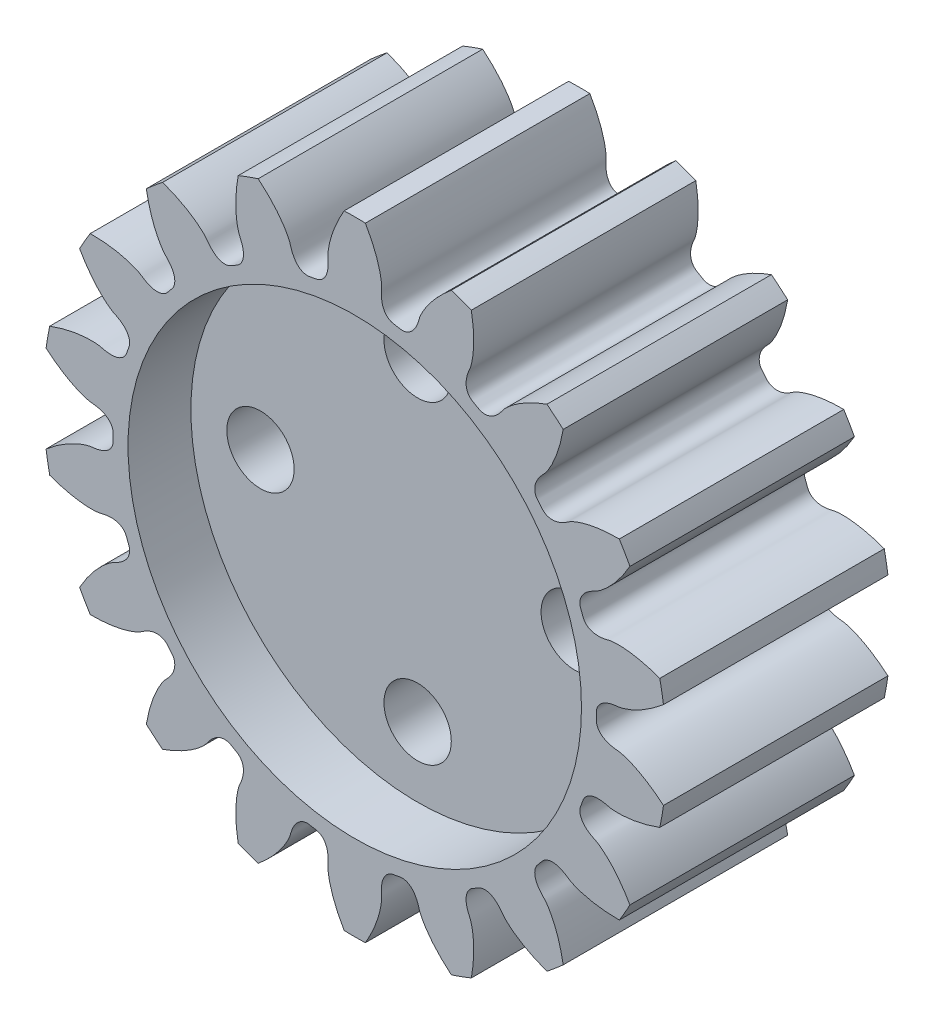
from build123d import *

# Parameters (mm, degrees)
SKETCHREVOLVESPURPINION_W       = 10
SKETCHREVOLVESPURPINION_H       = 13.888888889
TOOTHEXTRUDECUTSPURPINION_DEPTH = 9.525
PATTERNSPURPINION_COUNT         = 18
SKETCH_5_R                      = 10.1
CUT_EXTRUDE_2_DEPTH             = 2.8
SKETCH_6_R                      = 1.5
CUT_EXTRUDE_3_DEPTH             = 21.829359998


with BuildPart() as part:
    # SketchRevolveSpurPinion → SpurPinion (revolve)
    with BuildSketch(Plane(origin=(0, 0, 0), x_dir=(0, 0, -1), z_dir=(1, 0, 0))):
        with Locations((-4.525, 6.944444445)):
            Rectangle(SKETCHREVOLVESPURPINION_W, SKETCHREVOLVESPURPINION_H)
    revolve(axis=Axis((0, 0, 0), (0, 0, -1)))

    # SketchToothSpurPinion → ToothExtrudeCutSpurPinion (cut, symmetric)
    with BuildSketch(Plane.XY):
        with BuildLine():
            ThreePointArc((13.81461503, 1.997869118), (13.958333333, 0), (13.81461503, -1.997869118))
            add(Edge.make_bspline(
                [(13.81461503, -1.997869118), (13.698793969, -1.897449281), (13.525164787, -1.75589753), (13.291217146, -1.583686739), (13.126664421, -1.470510764), (12.96875534, -1.369204581), (12.81807175, -1.279218647), (12.675166862, -1.199978378), (12.540564252, -1.130885755), (12.414756935, -1.071320562), (12.298206492, -1.020641773), (12.191342258, -0.978188864), (12.094560541, -0.943283458), (12.008223976, -0.915230072), (11.932660705, -0.893319744), (11.868164321, -0.876825114), (11.814991796, -0.865020609), (11.773367259, -0.857132926), (11.743470731, -0.852473468), (11.725461955, -0.850148873), (11.690012991, -0.846916443), (11.647489464, -0.843589638), (11.594367814, -0.837043671), (11.556066215, -0.831645799), (11.518479821, -0.825530404), (11.481594494, -0.818726254), (11.445398127, -0.811217755), (11.409876051, -0.802996839), (11.375012208, -0.794048687), (11.340788852, -0.784354661), (11.307186718, -0.773890594), (11.274185169, -0.762626136), (11.241762499, -0.750523651), (11.209896404, -0.737537036), (11.1785647, -0.723610365), (11.147746379, -0.708676379), (11.117423111, -0.692654849), (11.087581348, -0.675450874), (11.0582152, -0.656953229), (11.029330316, -0.637032964), (11.000948966, -0.615542577), (10.973116556, -0.592316237), (10.94590969, -0.567171764), (10.919445694, -0.539915289), (10.893893157, -0.51034976), (10.869482403, -0.478288531), (10.846514049, -0.443575078), (10.825362479, -0.406109181), (10.806471485, -0.365878146), (10.790334245, -0.322990275), (10.777470535, -0.277701322), (10.768341668, -0.230436968), (10.763825199, -0.185573942), (10.761877337, -0.108617629), (10.76548092, 0), (10.761877337, 0.108617629), (10.763825199, 0.185573942), (10.768341668, 0.230436968), (10.777470535, 0.277701322), (10.790334245, 0.322990275), (10.806471485, 0.365878146), (10.825362479, 0.406109181), (10.846514049, 0.443575078), (10.869482403, 0.478288531), (10.893893157, 0.51034976), (10.919445694, 0.539915289), (10.94590969, 0.567171764), (10.973116556, 0.592316237), (11.000948966, 0.615542577), (11.029330316, 0.637032964), (11.0582152, 0.656953229), (11.087581348, 0.675450874), (11.117423111, 0.692654849), (11.147746379, 0.708676379), (11.1785647, 0.723610365), (11.209896404, 0.737537036), (11.241762499, 0.750523651), (11.274185169, 0.762626136), (11.307186718, 0.773890594), (11.340788852, 0.784354661), (11.375012208, 0.794048687), (11.409876051, 0.802996839), (11.445398127, 0.811217755), (11.481594494, 0.818726254), (11.518479821, 0.825530404), (11.556066215, 0.831645799), (11.594367814, 0.837043671), (11.647489464, 0.843589638), (11.690012991, 0.846916443), (11.725461955, 0.850148873), (11.743470731, 0.852473468), (11.773367259, 0.857132926), (11.814991796, 0.865020609), (11.868164321, 0.876825114), (11.932660705, 0.893319744), (12.008223976, 0.915230072), (12.094560541, 0.943283458), (12.191342258, 0.978188864), (12.298206492, 1.020641773), (12.414756935, 1.071320562), (12.540564252, 1.130885755), (12.675166862, 1.199978378), (12.81807175, 1.279218647), (12.96875534, 1.369204581), (13.126664421, 1.470510764), (13.291217146, 1.583686739), (13.525164787, 1.75589753), (13.698793969, 1.897449281), (13.81461503, 1.997869118)],
                knots=[0, 0, 0, 0, 0.059354085, 0.086688204, 0.112460372, 0.136670591, 0.159318861, 0.180405181, 0.199929551, 0.217891972, 0.234292443, 0.249130965, 0.262407537, 0.27412216, 0.284274833, 0.292865557, 0.299894332, 0.305361157, 0.309266033, 0.311608961, 0.312389947, 0.323048368, 0.328120377, 0.333111369, 0.338024664, 0.342863925, 0.347633206, 0.352337001, 0.356980291, 0.361568614, 0.366108128, 0.370605687, 0.375068927, 0.379506353, 0.383927434, 0.388342706, 0.392763858, 0.397203826, 0.401676849, 0.406198494, 0.410785613, 0.415456199, 0.420229099, 0.425123526, 0.43015831, 0.435350837, 0.440715626, 0.446262589, 0.451995067, 0.457907883, 0.463985799, 0.47020283, 0.476522841, 0.481419136, 0.5, 0.518580864, 0.523477159, 0.52979717, 0.536014201, 0.542092117, 0.548004933, 0.553737411, 0.559284374, 0.564649163, 0.56984169, 0.574876474, 0.579770901, 0.584543801, 0.589214387, 0.593801506, 0.598323151, 0.602796174, 0.607236142, 0.611657294, 0.616072566, 0.620493647, 0.624931073, 0.629394313, 0.633891872, 0.638431386, 0.643019709, 0.647662999, 0.652366794, 0.657136075, 0.661975336, 0.666888631, 0.671879623, 0.676951632, 0.687610053, 0.688391039, 0.690733967, 0.694638843, 0.700105668, 0.707134443, 0.715725167, 0.72587784, 0.737592463, 0.750869035, 0.765707557, 0.782108028, 0.800070449, 0.819594819, 0.840681139, 0.863329409, 0.887539628, 0.913311796, 0.940645915, 1, 1, 1, 1], degree=3))
        make_face()
    toothextrudecutspurpinion = extrude(amount=TOOTHEXTRUDECUTSPURPINION_DEPTH, both=True, mode=Mode.SUBTRACT)

    # PatternSpurPinion: ToothExtrudeCutSpurPinion ×18 about axis
    patternspurpinion_axis = Axis((0, 0, 50), (0, 0, -1))
    for i in range(1, PATTERNSPURPINION_COUNT):
        add(toothextrudecutspurpinion.rotate(patternspurpinion_axis, i * 360 / PATTERNSPURPINION_COUNT), mode=Mode.SUBTRACT)

    # Эскиз5 → Вырез-Вытянуть2 (cut)
    with BuildSketch(Plane.XY.offset(9.525)):
        Circle(SKETCH_5_R)
    extrude(amount=-CUT_EXTRUDE_2_DEPTH, mode=Mode.SUBTRACT)

    # Эскиз6 → Вырез-Вытянуть3 (cut, through all)
    with BuildSketch(Plane.XY.offset(6.725)):
        with Locations((0, 7)):
            Circle(SKETCH_6_R)
        with Locations((7, 0)):
            Circle(SKETCH_6_R)
        with Locations((0, -7)):
            Circle(SKETCH_6_R)
        with Locations((-7, 0)):
            Circle(SKETCH_6_R)
    extrude(amount=-CUT_EXTRUDE_3_DEPTH, mode=Mode.SUBTRACT)


solid = part.part
